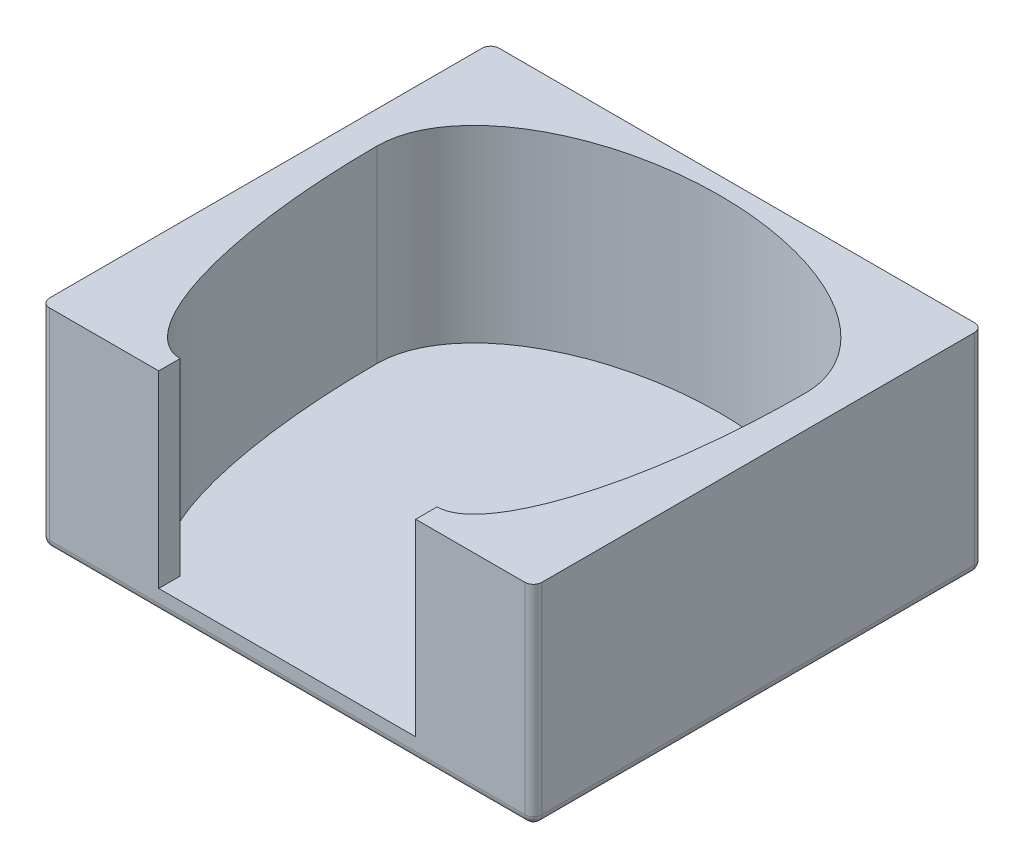
from build123d import *

# Parameters (mm, degrees)
SKETCH2_W           = 57.5
SKETCH2_H           = 52.5
BOSS_EXTRUDE1_DEPTH = 2.5
BOSS_EXTRUDE2_DEPTH = 22
FILLET1_R           = 1


with BuildPart() as part:
    # Sketch2 → Boss-Extrude1 (new body)
    with BuildSketch(Plane(origin=(0, 0, 0), x_dir=(1, 0, 0), z_dir=(0, 1, 0))):
        Rectangle(SKETCH2_W, SKETCH2_H)
    extrude(amount=BOSS_EXTRUDE1_DEPTH)

    # Sketch3 → Boss-Extrude2 (add)
    with BuildSketch(Plane(origin=(0, 2.5, 0), x_dir=(1, 0, 0), z_dir=(0, 1, 0))):
        with BuildLine():
            Line((-15, -26.25), (-15, -23.75))
            add(Edge.make_bspline(
                [(-25, 9.25), (-25, -23.75), (-15, -23.75)],
                knots=[4.71238898, 4.71238898, 4.71238898, 6.283185307, 6.283185307, 6.283185307], degree=2, weights=[1, 0.707106781, 1]))
            add(Edge.make_bspline(
                [(25, 9.25), (25, 24.25), (0, 24.25), (-25, 24.25), (-25, 9.25)],
                knots=[3.141592654, 3.141592654, 3.141592654, 4.71238898, 4.71238898, 6.283185307, 6.283185307, 6.283185307], degree=2, weights=[1, 0.707106781, 1, 0.707106781, 1]))
            add(Edge.make_bspline(
                [(15, -23.75), (25, -23.75), (25, 9.25)],
                knots=[0, 0, 0, 1.570796327, 1.570796327, 1.570796327], degree=2, weights=[1, 0.707106781, 1]))
            Line((15, -23.75), (15, -26.25))
            Line((15, -26.25), (28.75, -26.25))
            Line((28.75, -26.25), (28.75, 26.25))
            Line((28.75, 26.25), (-28.75, 26.25))
            Line((-28.75, 26.25), (-28.75, -26.25))
            Line((-28.75, -26.25), (-15, -26.25))
        make_face()
    extrude(amount=BOSS_EXTRUDE2_DEPTH)

    # Fillet1
    fillet1_edges = [part.edges().sort_by_distance(p)[0] for p in [
        (0, 0, -26.25),
        (28.75, 0, 0),
        (0, 0, 26.25),
        (-28.75, 0, 0),
        (-28.75, 12.25, -26.25),
        (28.75, 12.25, -26.25),
        (28.75, 12.25, 26.25),
        (-28.75, 12.25, 26.25),
    ]]
    fillet(fillet1_edges, radius=FILLET1_R)


solid = part.part
